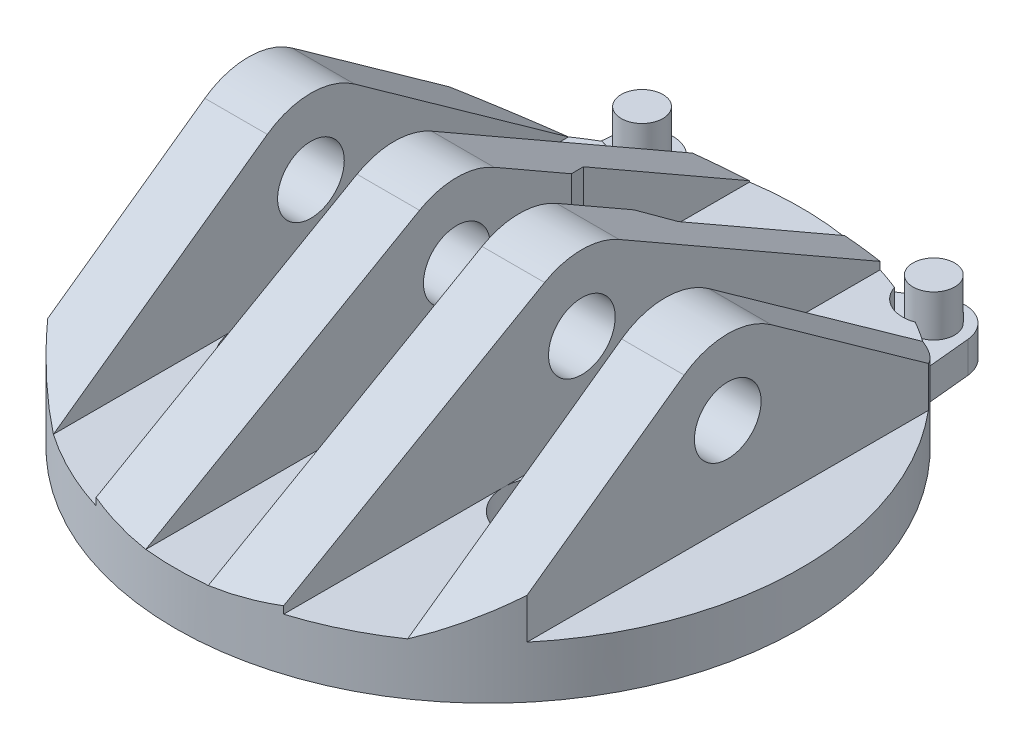
from build123d import *
from build123d.topology import SkipClean

# Parameters (mm, degrees)
SKETCH1_R           = 30
SKETCH1_R_2         = 2.1
BOSS_EXTRUDE1_DEPTH = 5
SKETCH7_R           = 4
CUT_EXTRUDE2_DEPTH  = 2
BOSS_EXTRUDE5_DEPTH = 16
SKETCH8_R           = 3.2
CUT_EXTRUDE3_DEPTH  = 65.420493634
CUT_EXTRUDE4_REACH  = 51.295
CUT_EXTRUDE5_REACH  = 61.582
BOSS_EXTRUDE8_DEPTH = 3
CUT_EXTRUDE8_START  = -2
CUT_EXTRUDE8_DEPTH  = 2
SKETCH14_R          = 2
BOSS_EXTRUDE9_DEPTH = 4


with BuildPart() as part:
    # Sketch1 → Boss-Extrude1 (new body)
    with BuildSketch(Plane(origin=(0, 0, 0), x_dir=(1, 0, 0), z_dir=(0, 1, 0))):
        with Locations(Location((0, 0, 0), (0, 0, 270))):
            Circle(SKETCH1_R)
        with Locations(Location((0, 15, 0), (0, 0, 270))):
            Circle(SKETCH1_R_2, mode=Mode.SUBTRACT)
        with Locations(Location((12.990381057, -7.5, 0), (0, 0, 270))):
            Circle(SKETCH1_R_2, mode=Mode.SUBTRACT)
        with Locations(Location((-12.990381057, -7.5, 0), (0, 0, 270))):
            Circle(SKETCH1_R_2, mode=Mode.SUBTRACT)
    extrude(amount=BOSS_EXTRUDE1_DEPTH)

    # Sketch7 → Cut-Extrude2 (cut)
    with BuildSketch(Plane(origin=(0, 5, 0), x_dir=(1, 0, 0), z_dir=(0, 1, 0))):
        with Locations(Location((0, 15, 0), (0, 0, 270))):
            Circle(SKETCH7_R)
        with Locations(Location((12.990381057, -7.5, 0), (0, 0, 270))):
            Circle(SKETCH7_R)
        with Locations(Location((-12.990381057, -7.5, 0), (0, 0, 270))):
            Circle(SKETCH7_R)
    extrude(amount=-CUT_EXTRUDE2_DEPTH, mode=Mode.SUBTRACT)

    # Sketch2 → Boss-Extrude5 (add)
    with BuildSketch(Plane(origin=(0, 5, 0), x_dir=(1, 0, 0), z_dir=(0, 1, 0))):
        with BuildLine():
            Line((23, -19.261360284), (23, 19.261360284))
            ThreePointArc((23, 19.261360284), (20.18526342, 22.193583322), (17, 24.718414189))
            Line((17, 24.718414189), (17, -24.718414189))
            ThreePointArc((17, -24.718414189), (20.18526342, -22.193583322), (23, -19.261360284))
        make_face()
        with BuildLine():
            Line((9, -28.618176043), (9, 28.618176043))
            ThreePointArc((9, 28.618176043), (6.798137481, 29.219605178), (4.556921938, 29.651888008))
            Line((4.556921938, 29.651888008), (4.556921938, 13.6966679))
            Line((4.556921938, 13.6966679), (3, 11))
            Line((3, 11), (3, -29.849623113))
            ThreePointArc((3, -29.849623113), (6.031510215, -29.387427321), (9, -28.618176043))
        make_face()
    boss_extrude5 = extrude(amount=BOSS_EXTRUDE5_DEPTH)

    # Sketch8 → Cut-Extrude3 (cut, through all)
    with BuildSketch(Plane(origin=(23, 0, 0), x_dir=(0, 0, -1), z_dir=(1, 0, 0))):
        with Locations((0, 13.8)):
            Circle(SKETCH8_R)
    cut_extrude3 = extrude(amount=-CUT_EXTRUDE3_DEPTH, mode=Mode.SUBTRACT)

    # Sketch9 → Cut-Extrude4 (cut, up to next)
    with BuildSketch(Plane.ZY.offset(-3), mode=Mode.PRIVATE) as cut_extrude4_sk1:
        Polygon((-29.651888008, 21), (-29.651888008, 5.113260013), (-11, 15.796811053), (-11, 21), (-13.6966679, 21), align=None)
    cut_extrude4_tool1 = extrude(cut_extrude4_sk1.sketch, amount=-CUT_EXTRUDE4_REACH, mode=Mode.PRIVATE) & part.part
    # Sketch9 → Cut-Extrude4 (cut, up to next)
    with BuildSketch(Plane.ZY.offset(-3), mode=Mode.PRIVATE) as cut_extrude4_sk2:
        with BuildLine():
            Line((-11, 21), (-11, 15.796811053))
            Line((-11, 15.796811053), (-3.578594408, 20.047692539))
            ThreePointArc((-3.578594408, 20.047692539), (-1.851568785, 20.757851179), (-5.9e-08, 21))
            Line((-5.9e-08, 21), (-11, 21))
        make_face()
    cut_extrude4_tool2 = extrude(cut_extrude4_sk2.sketch, amount=-CUT_EXTRUDE4_REACH, mode=Mode.PRIVATE) & part.part
    # Sketch9 → Cut-Extrude4 (cut, up to next)
    with BuildSketch(Plane.ZY.offset(-3), mode=Mode.PRIVATE) as cut_extrude4_sk3:
        with BuildLine():
            Line((29.849623113, 21), (-5.9e-08, 21))
            ThreePointArc((-5.9e-08, 21), (1.851568727, 20.757851195), (3.578594408, 20.047692539))
            Line((3.578594408, 20.047692539), (29.849623113, 5))
            Line((29.849623113, 5), (29.849623113, 21))
        make_face()
    cut_extrude4_tool3 = extrude(cut_extrude4_sk3.sketch, amount=-CUT_EXTRUDE4_REACH, mode=Mode.PRIVATE) & part.part
    cut_extrude4_1 = cut_extrude4_tool1.solids().sort_by_distance((3, 15.276519, -21.900696))[0]
    add(cut_extrude4_1, mode=Mode.SUBTRACT)
    cut_extrude4_2 = cut_extrude4_tool2.solids().sort_by_distance((3, 19.285722, -7.892308))[0]
    add(cut_extrude4_2, mode=Mode.SUBTRACT)
    cut_extrude4_3 = cut_extrude4_tool3.solids().sort_by_distance((3, 15.673845, 20.512344))[0]
    add(cut_extrude4_3, mode=Mode.SUBTRACT)
    cut_extrude4 = cut_extrude4_1 + cut_extrude4_2 + cut_extrude4_3  # Cut-Extrude4 as one shape, for the pattern or mirror that repeats it

    # Sketch10 → Cut-Extrude5 (cut, up to next)
    with BuildSketch(Plane.ZY.offset(-17), mode=Mode.PRIVATE) as cut_extrude5_sk1:
        with BuildLine():
            Line((-24.718414189, 21), (-24.718414189, 5))
            Line((-24.718414189, 5), (-4.183421259, 19.659947659))
            ThreePointArc((-4.183421259, 19.659947659), (-2.196403521, 20.656807681), (0, 21))
            Line((0, 21), (-24.718414189, 21))
        make_face()
    cut_extrude5_tool1 = extrude(cut_extrude5_sk1.sketch, amount=-CUT_EXTRUDE5_REACH, mode=Mode.PRIVATE) & part.part
    # Sketch10 → Cut-Extrude5 (cut, up to next)
    with BuildSketch(Plane.ZY.offset(-17), mode=Mode.PRIVATE) as cut_extrude5_sk2:
        with BuildLine():
            Line((4.183421259, 19.659947659), (24.718414189, 5))
            Line((24.718414189, 5), (24.718414189, 21))
            Line((24.718414189, 21), (0, 21))
            ThreePointArc((0, 21), (2.196403521, 20.656807681), (4.183421259, 19.659947659))
        make_face()
    cut_extrude5_tool2 = extrude(cut_extrude5_sk2.sketch, amount=-CUT_EXTRUDE5_REACH, mode=Mode.PRIVATE) & part.part
    cut_extrude5_1 = cut_extrude5_tool1.solids().sort_by_distance((17, 15.681733, -17.202981))[0]
    add(cut_extrude5_1, mode=Mode.SUBTRACT)
    cut_extrude5_2 = cut_extrude5_tool2.solids().sort_by_distance((17, 15.681733, 17.202981))[0]
    add(cut_extrude5_2, mode=Mode.SUBTRACT)
    cut_extrude5 = cut_extrude5_1 + cut_extrude5_2  # Cut-Extrude5 as one shape, for the pattern or mirror that repeats it

    # Mirror1: Boss-Extrude5, Cut-Extrude3, Cut-Extrude4, Cut-Extrude5 across plane
    with SkipClean():  # the faces are left unmerged after this step: merging them gives an invalid solid
        add(boss_extrude5.mirror(Plane.ZY))
        add(cut_extrude3.mirror(Plane.ZY), mode=Mode.SUBTRACT)
        add(cut_extrude4.mirror(Plane.ZY), mode=Mode.SUBTRACT)
        add(cut_extrude5.mirror(Plane.ZY), mode=Mode.SUBTRACT)

    # Sketch13 → Boss-Extrude8 (add)
    with SkipClean():  # the faces are left unmerged after this step: merging them gives an invalid solid
        with BuildSketch(Plane.XZ):
            with BuildLine():
                ThreePointArc((12.385089192, -31.30324211), (15.3125, -31.472644372), (16.98597293, -29.064757431))
                Line((16.98597293, -29.064757431), (17.437516579, -24.411739298))
                ThreePointArc((17.437516579, -24.411739298), (13.125, -26.976552319), (8.445332472, -28.786739298))
                Line((8.445332472, -28.786739298), (12.385089192, -31.30324211))
            make_face()
        boss_extrude8 = extrude(amount=-BOSS_EXTRUDE8_DEPTH)

    # Sketch15 → Cut-Extrude8 (cut)
    with SkipClean():  # the faces are left unmerged after this step: merging them gives an invalid solid
        with BuildSketch(Plane(origin=(0, 5, 0), x_dir=(1, 0, 0), z_dir=(0, 1, 0)).offset(CUT_EXTRUDE8_START)):
            with BuildLine():
                ThreePointArc((15.036417377, 25.959702472), (13.125, 26.976552319), (11.145223248, 27.852899288))
                ThreePointArc((11.145223248, 27.852899288), (12.6875, 26.077333908), (15.036417377, 25.959702472))
            make_face()
            with BuildLine():
                ThreePointArc((17, 28.77498914), (13.533272165, 31.738460943), (11.145223248, 27.852899288))
                ThreePointArc((11.145223248, 27.852899288), (13.125, 26.976552319), (15.036417377, 25.959702472))
                ThreePointArc((15.036417377, 25.959702472), (16.460614977, 27.058779964), (17, 28.77498914))
            make_face()
        cut_extrude8 = extrude(amount=CUT_EXTRUDE8_DEPTH, mode=Mode.SUBTRACT)

    # Sketch14 → Boss-Extrude9 (add)
    with SkipClean():  # the faces are left unmerged after this step: merging them gives an invalid solid
        with BuildSketch(Plane(origin=(0, 3, 0), x_dir=(1, 0, 0), z_dir=(0, 1, 0))):
            with Locations(Location((14, 28.77498914, 0), (0, 0, 90))):
                Circle(SKETCH14_R)
        boss_extrude9 = extrude(amount=BOSS_EXTRUDE9_DEPTH)

    # Mirror2: Boss-Extrude8, Cut-Extrude8, Boss-Extrude9 across plane
    with SkipClean():  # the faces are left unmerged after this step: merging them gives an invalid solid
        add(boss_extrude8.mirror(Plane.ZY))
        add(cut_extrude8.mirror(Plane.ZY), mode=Mode.SUBTRACT)
        add(boss_extrude9.mirror(Plane.ZY))


solid = part.part
